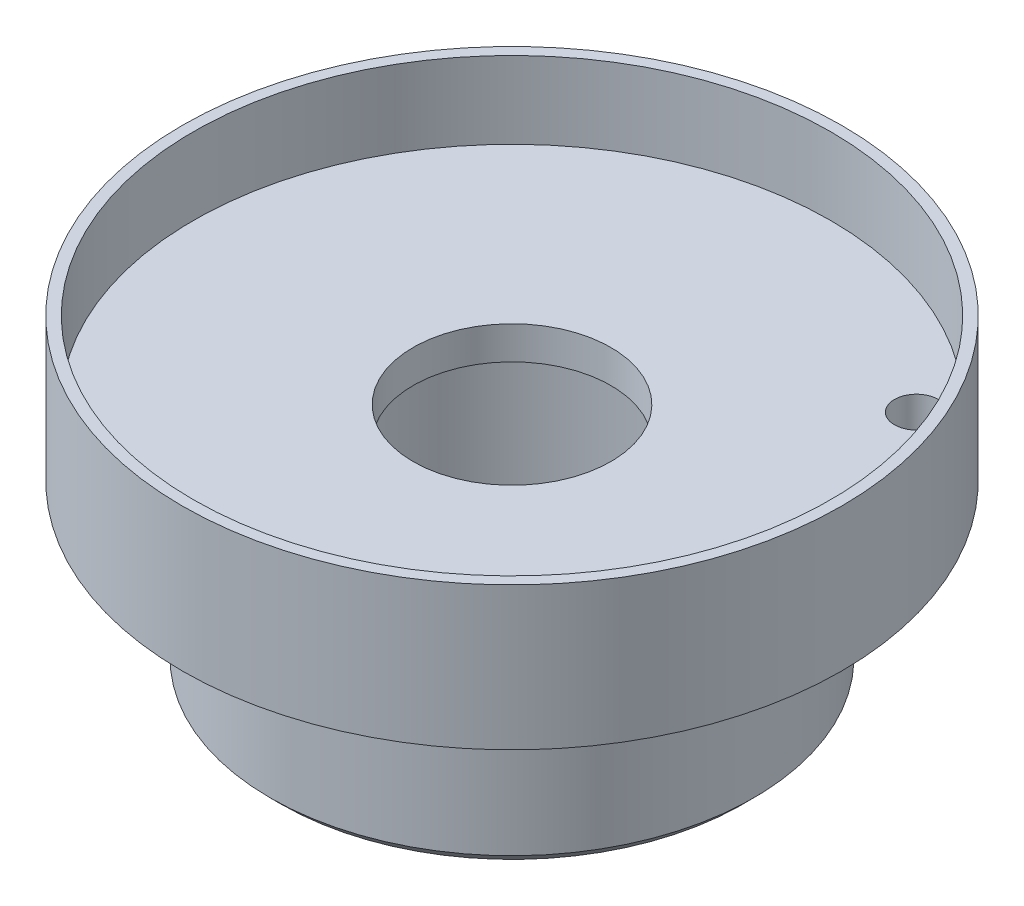
from build123d import *

# Parameters (mm, degrees)
ESQUISSE1_R              = 11
BOSS_EXTRU_1_DEPTH       = 7.5
ESQUISSE3_R              = 15
BOSS_EXTRU_2_DEPTH       = 6.5
CHANFREIN1_SIZE          = 0.5
CHANFREIN2_SIZE          = 1
ESQUISSE4_R              = 14.5
ENL_V_MAT_EXTRU_1_DEPTH  = 3.5
ESQUISSE5_R              = 4.5
ENL_V_MAT_EXTRU_2_DEPTH  = 1.5
ESQUISSE6_R              = 7
ENL_V_MAT_EXTRU_3_DEPTH  = 1
ESQUISSE20_R             = 8
ENL_V_MAT_EXTRU_4_DEPTH  = 8
F_2_0_2_DIAMETER_HOLE1_D = 2


with BuildPart() as part:
    # Esquisse1 → Boss.-Extru.1 (new body)
    with BuildSketch(Plane(origin=(0, 0, 0), x_dir=(1, 0, 0), z_dir=(0, 1, 0))):
        with Locations(Location((0, 0, 0), (0, 0, 270))):
            Circle(ESQUISSE1_R)
    extrude(amount=BOSS_EXTRU_1_DEPTH)

    # Esquisse3 → Boss.-Extru.2 (add)
    with BuildSketch(Plane(origin=(0, 7.5, 0), x_dir=(1, 0, 0), z_dir=(0, 1, 0))):
        with Locations(Location((0, 0, 0), (0, 0, 90))):
            Circle(ESQUISSE3_R)
    extrude(amount=BOSS_EXTRU_2_DEPTH)

    # Chanfrein1
    chanfrein1_edges = [part.edges().sort_by_distance(p)[0] for p in [
        (0, 0, -11),
    ]]
    chamfer(chanfrein1_edges, length=CHANFREIN1_SIZE)

    # Chanfrein2
    chanfrein2_edges = [part.edges().sort_by_distance(p)[0] for p in [
        (0, 7.5, -11),
    ]]
    chamfer(chanfrein2_edges, length=CHANFREIN2_SIZE)

    # Esquisse4 → Enlèv. mat.-Extru.1 (cut)
    with BuildSketch(Plane(origin=(0, 14, 0), x_dir=(1, 0, 0), z_dir=(0, 1, 0))):
        with Locations(Location((0, 0, 0), (0, 0, 270))):
            Circle(ESQUISSE4_R)
    extrude(amount=-ENL_V_MAT_EXTRU_1_DEPTH, mode=Mode.SUBTRACT)

    # Esquisse5 → Enlèv. mat.-Extru.2 (cut)
    with BuildSketch(Plane(origin=(0, 10.5, 0), x_dir=(1, 0, 0), z_dir=(0, 1, 0))):
        with Locations(Location((0, 0, 0), (0, 0, 270))):
            Circle(ESQUISSE5_R)
    extrude(amount=-ENL_V_MAT_EXTRU_2_DEPTH, mode=Mode.SUBTRACT)

    # Esquisse6 → Enlèv. mat.-Extru.3 (cut)
    with BuildSketch(Plane(origin=(0, 9, 0), x_dir=(1, 0, 0), z_dir=(0, 1, 0))):
        with Locations(Location((0, 0, 0), (0, 0, 270))):
            Circle(ESQUISSE6_R)
    extrude(amount=-ENL_V_MAT_EXTRU_3_DEPTH, mode=Mode.SUBTRACT)

    # Esquisse20 → Enlèv. mat.-Extru.4 (cut)
    with BuildSketch(Plane(origin=(0, 8, 0), x_dir=(1, 0, 0), z_dir=(0, 1, 0))):
        with Locations(Location((0, 0, 0), (0, 0, 270))):
            Circle(ESQUISSE20_R)
    extrude(amount=-ENL_V_MAT_EXTRU_4_DEPTH, mode=Mode.SUBTRACT)

    # Ø2.0 (2) Diameter Hole1 (through all)
    with Locations(Plane(origin=(0, 7.5, 0), x_dir=(-1, 0, 0), z_dir=(0, -1, 0))):
        with Locations((-9.5, 8.9)):
            Hole(F_2_0_2_DIAMETER_HOLE1_D / 2)


solid = part.part
